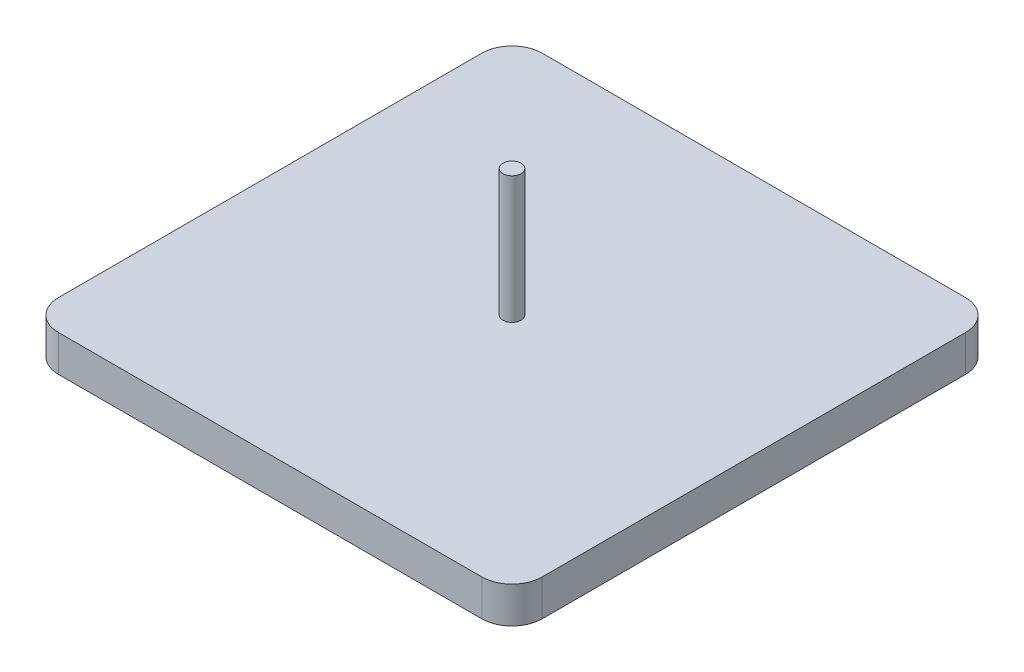
from build123d import *

# Parameters (mm, degrees)
SKETCH1_W                = 80
SKETCH1_H                = 80
BOSS_EXTRUDE1_DEPTH      = 6
FILLET1_R                = 5
BOSS_EXTRUDE2_DEPTH      = 21
BOSS_EXTRUDE2_DEPTH_BACK = 3


with BuildPart() as part:
    # Sketch1 → Boss-Extrude1 (new body)
    with BuildSketch(Plane(origin=(0, 0, 0), x_dir=(1, 0, 0), z_dir=(0, 1, 0))):
        with Locations((18.575784079, 13.984880667)):
            Rectangle(SKETCH1_W, SKETCH1_H)
    extrude(amount=BOSS_EXTRUDE1_DEPTH)

    # Fillet1
    fillet1_edges = [part.edges().sort_by_distance(p)[0] for p in [
        (-21.424215921, 3, -53.984880667),
        (58.575784079, 3, -53.984880667),
        (58.575784079, 3, 26.015119333),
        (-21.424215921, 3, 26.015119333),
    ]]
    fillet(fillet1_edges, radius=FILLET1_R)

    # Sketch3 → Boss-Extrude2 (add, two sides: drawn at the far end of the back side and taken through both)
    with BuildSketch(Plane(origin=(0, 6, 0), x_dir=(1, 0, 0), z_dir=(0, 1, 0)).offset(-BOSS_EXTRUDE2_DEPTH_BACK)):
        with BuildLine():
            ThreePointArc((20.075784079, 13.984880667), (19.63644425, 15.045540839), (18.575784079, 15.484880667))
            Line((18.575784079, 15.484880667), (18.575784079, 13.984880667))
            Line((18.575784079, 13.984880667), (20.075784079, 13.984880667))
        make_face()
        with BuildLine():
            Line((18.575784079, 13.984880667), (18.575784079, 15.484880667))
            ThreePointArc((18.575784079, 15.484880667), (17.515123907, 15.045540839), (17.075784079, 13.984880667))
            Line((17.075784079, 13.984880667), (18.575784079, 13.984880667))
        make_face()
        with BuildLine():
            Line((20.075784079, 13.984880667), (18.575784079, 13.984880667))
            Line((18.575784079, 13.984880667), (18.575784079, 12.484880667))
            ThreePointArc((18.575784079, 12.484880667), (19.63644425, 12.924220495), (20.075784079, 13.984880667))
        make_face()
        with BuildLine():
            Line((18.575784079, 12.484880667), (18.575784079, 13.984880667))
            Line((18.575784079, 13.984880667), (17.075784079, 13.984880667))
            ThreePointArc((17.075784079, 13.984880667), (17.515123907, 12.924220495), (18.575784079, 12.484880667))
        make_face()
    extrude(amount=BOSS_EXTRUDE2_DEPTH + BOSS_EXTRUDE2_DEPTH_BACK)


solid = part.part
